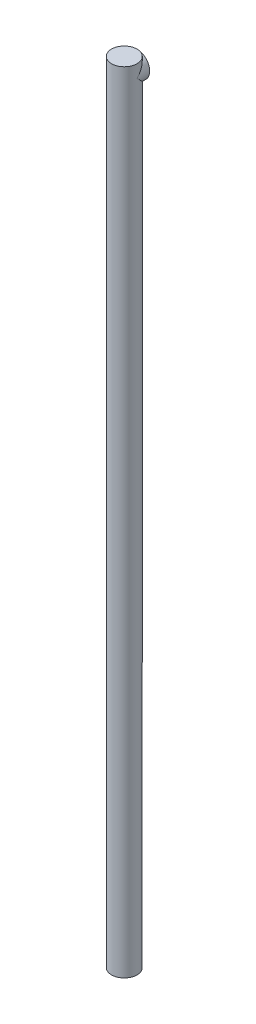
from build123d import *

# Parameters (mm, degrees)
SKETCH_1_R      = 2.5
EXTRUDE_1_DEPTH = 155
SKETCH_2_R      = 2.5
EXTRUDE_2_DEPTH = 2.5


with BuildPart() as part:
    # 스케치1 → 보스-돌출1 (new body)
    with BuildSketch(Plane(origin=(0, 0, 0), x_dir=(1, 0, 0), z_dir=(0, 1, 0))):
        with Locations(Location((0, 0, 0), (0, 0, 270))):
            Circle(SKETCH_1_R)
    extrude(amount=EXTRUDE_1_DEPTH)

    # 스케치2 → 보스-돌출2 (add)
    with BuildSketch(Plane.XY):
        with Locations((0, 152.5)):
            Circle(SKETCH_2_R)
    extrude(amount=-EXTRUDE_2_DEPTH)


solid = part.part
